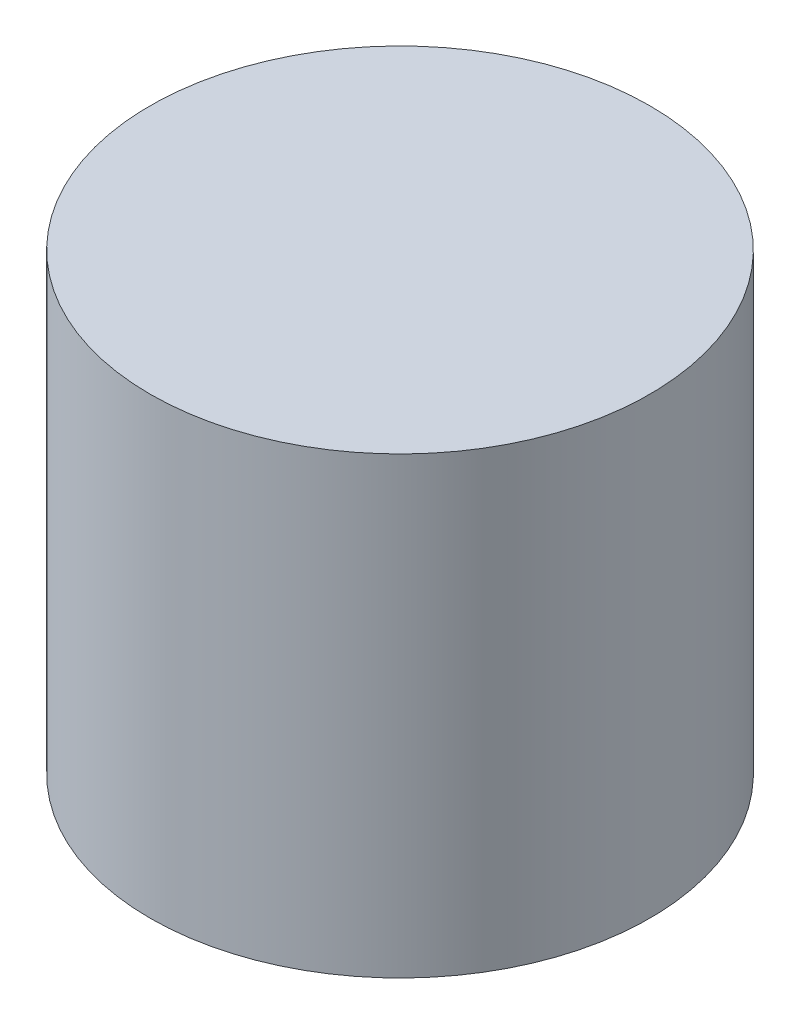
from build123d import *

# Parameters (mm, degrees)
SKETCH1_R           = 41.948250612
BOSS_EXTRUDE1_DEPTH = 76.2


with BuildPart() as part:
    # Sketch1 → Boss-Extrude1 (new body)
    with BuildSketch(Plane(origin=(0, 0, 0), x_dir=(1, 0, 0), z_dir=(0, 1, 0))):
        with Locations(Location((0, 0, 0), (0, 0, 90))):
            Circle(SKETCH1_R)
    extrude(amount=BOSS_EXTRUDE1_DEPTH)


solid = part.part
